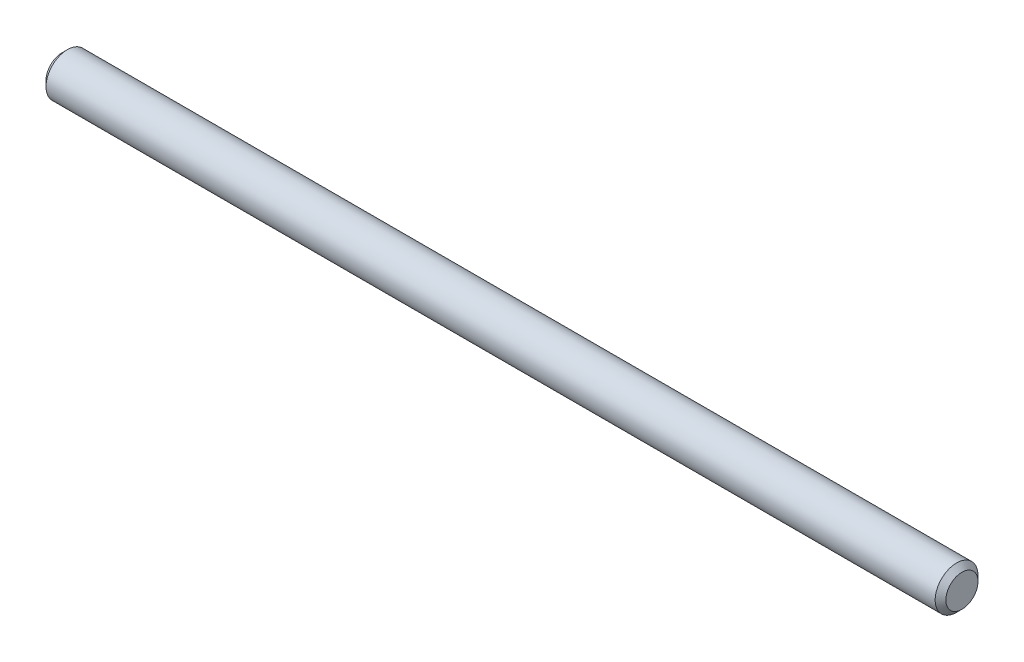
from build123d import *

# Parameters (mm, degrees)
SKETCH1_R           = 2
BOSS_EXTRUDE1_DEPTH = 42
CHAMFER1_SIZE       = 0.5


with BuildPart() as part:
    # Sketch1 → Boss-Extrude1 (new, symmetric)
    with BuildSketch(Plane(origin=(0, 0, 0), x_dir=(0, 0, -1), z_dir=(1, 0, 0))):
        with Locations(Location((0, 0, 0), (0, 0, 180))):
            Circle(SKETCH1_R)
    extrude(amount=BOSS_EXTRUDE1_DEPTH, both=True)

    # Chamfer1
    chamfer1_edges = [part.edges().sort_by_distance(p)[0] for p in [
        (-42, 0, -2),
        (42, 0, -2),
    ]]
    chamfer(chamfer1_edges, length=CHAMFER1_SIZE)


solid = part.part
